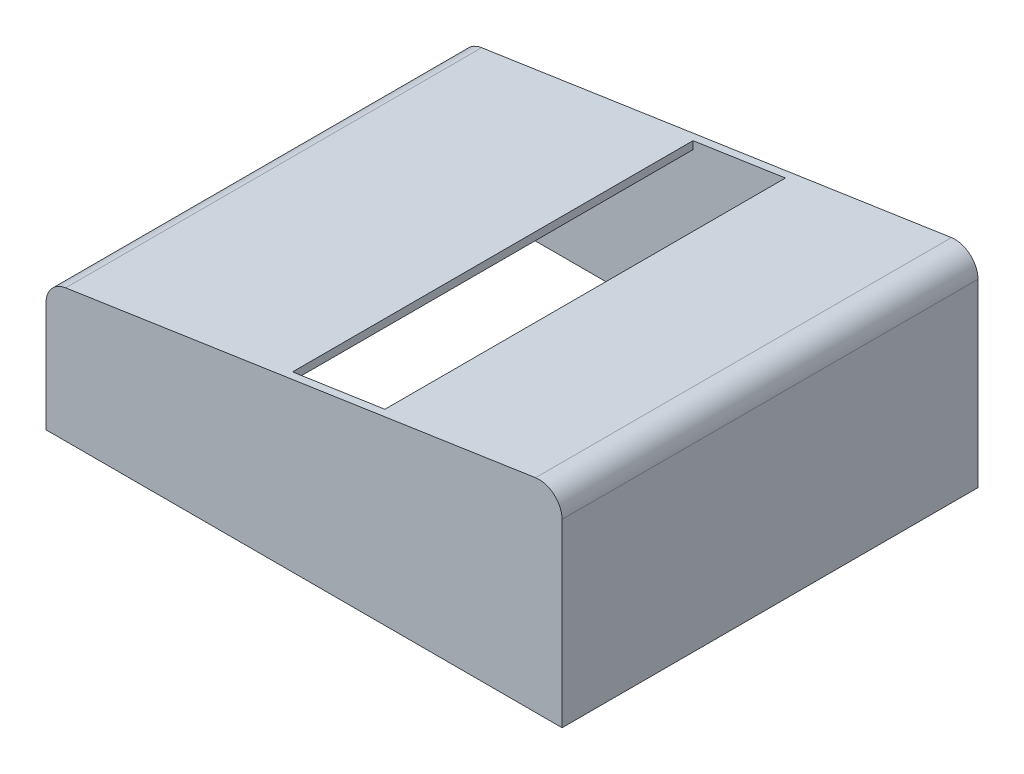
from build123d import *

# Parameters (mm, degrees)
BOSS_EXTRUDE1_DEPTH = 530
CUT_EXTRUDE1_DEPTH  = 520
BOSS_EXTRUDE2_START = 10
BOSS_EXTRUDE2_DEPTH = 10
SKETCH4_W           = 120
SKETCH4_H           = 520
CUT_EXTRUDE2_DEPTH  = 313


with BuildPart() as part:
    # Sketch2 → Boss-Extrude1 (new body)
    with BuildSketch(Plane.XY):
        with BuildLine():
            Line((660, -10), (660, 224.276251584))
            ThreePointArc((660, 224.276251584), (649.576690123, 247.008457896), (625.549786412, 253.94434217))
            Line((625.549786412, 253.94434217), (15.549786412, 162.44434217))
            ThreePointArc((15.549786412, 162.44434217), (-2.732206312, 152.352941707), (-10, 132.776251584))
            Line((-10, 132.776251584), (-10, -10))
            Line((-10, -10), (660, -10))
        make_face()
    extrude(amount=-BOSS_EXTRUDE1_DEPTH)

    # Sketch2<3> → Cut-Extrude1 (cut)
    with BuildSketch(Plane.XY):
        with BuildLine():
            Line((650, -10), (650, 0))
            Line((650, 0), (650, 224.276251584))
            ThreePointArc((650, 224.276251584), (643.051126749, 239.431055792), (627.033190941, 244.054978641))
            Line((627.033190941, 244.054978641), (17.033190941, 152.554978641))
            ThreePointArc((17.033190941, 152.554978641), (4.845195792, 145.827378333), (0, 132.776251584))
            Line((0, 132.776251584), (0, 0))
            Line((0, 0), (0, -10))
            Line((0, -10), (650, -10))
        make_face()
    extrude(amount=-CUT_EXTRUDE1_DEPTH, mode=Mode.SUBTRACT)

    # Sketch2<4> → Boss-Extrude2 (add)
    with BuildSketch(Plane.XY.offset(BOSS_EXTRUDE2_START)):
        with BuildLine():
            Line((660, -10), (660, 224.276251584))
            ThreePointArc((660, 224.276251584), (649.576690123, 247.008457896), (625.549786412, 253.94434217))
            Line((625.549786412, 253.94434217), (15.549786412, 162.44434217))
            ThreePointArc((15.549786412, 162.44434217), (-2.732206312, 152.352941707), (-10, 132.776251584))
            Line((-10, 132.776251584), (-10, -10))
            Line((-10, -10), (660, -10))
        make_face()
    extrude(amount=-BOSS_EXTRUDE2_DEPTH)

    # Sketch4 → Cut-Extrude2 (cut)
    with BuildSketch(Plane(origin=(0, 0, 0), x_dir=(1, 0, 0), z_dir=(0, 1, 0))):
        with Locations((360, 260)):
            Rectangle(SKETCH4_W, SKETCH4_H)
    extrude(amount=CUT_EXTRUDE2_DEPTH, mode=Mode.SUBTRACT)


solid = part.part
